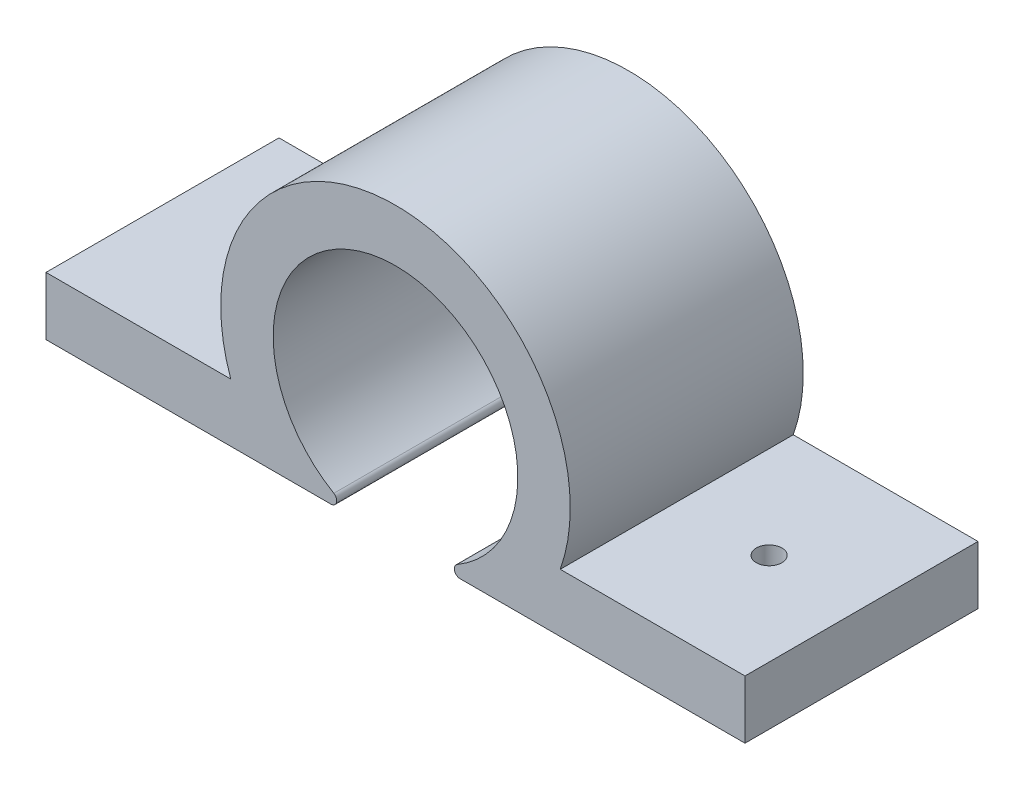
from build123d import *

# Parameters (mm, degrees)
BOSS_EXTRUDE1_DEPTH = 20
SKETCH3_R           = 10.5
CUT_EXTRUDE1_DEPTH  = 43.5
SKETCH4_R           = 1.1
CUT_EXTRUDE2_DEPTH  = 5
FILLET1_R           = 0.5


with BuildPart() as part:
    # Sketch1 → Boss-Extrude1 (new body)
    with BuildSketch(Plane.XY):
        with BuildLine():
            Line((14.142135624, 2.5), (30, 2.5))
            Line((30, 2.5), (30, -2.5))
            Line((30, -2.5), (-30, -2.5))
            Line((-30, -2.5), (-30, 2.5))
            Line((-30, 2.5), (-14.142135624, 2.5))
            ThreePointArc((-14.142135624, 2.5), (0, 22.5), (14.142135624, 2.5))
        make_face()
    extrude(amount=BOSS_EXTRUDE1_DEPTH)

    # Sketch3 → Cut-Extrude1 (cut, through all)
    with BuildSketch(Plane.XY.offset(20)):
        with Locations((0, 7.5)):
            Circle(SKETCH3_R)
    extrude(amount=-CUT_EXTRUDE1_DEPTH, mode=Mode.SUBTRACT)

    # Sketch4 → Cut-Extrude2 (cut)
    with BuildSketch(Plane(origin=(0, 2.5, 0), x_dir=(1, 0, 0), z_dir=(0, 1, 0))):
        with Locations(Location((-22.071067812, -10, 0), (0, 0, 270))):
            Circle(SKETCH4_R)
        with Locations(Location((22.071067812, -10, 0), (0, 0, 270))):
            Circle(SKETCH4_R)
    extrude(amount=-CUT_EXTRUDE2_DEPTH, mode=Mode.SUBTRACT)

    # Fillet1
    fillet1_edges = [part.edges().sort_by_distance(p)[0] for p in [
        (-3.201562119, -2.5, 10),
        (3.201562119, -2.5, 10),
    ]]
    fillet(fillet1_edges, radius=FILLET1_R)


solid = part.part
